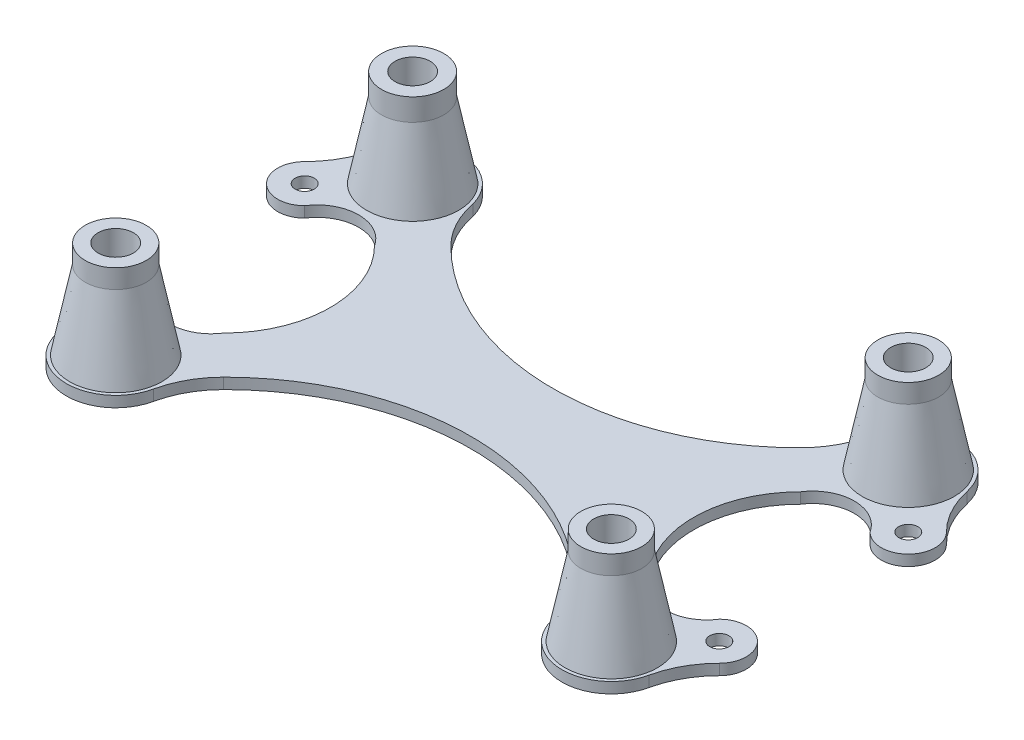
from build123d import *

# Parameters (mm, degrees)
BOSS_EXTRUDE1_DEPTH   = 2.54
SKETCH1_4_R           = 7.325
SKETCH1_4_R_2         = 4.15
SKETCH1_4_R_3         = 7.175
BOSS_EXTRUDE2_DEPTH   = 25.4
F_8_CLEARANCE_HOLE2_D = 4.4958
LPATTERN1_COUNT       = 2
LPATTERN1_PITCH       = 116.586
LPATTERN1_COUNT_DIR2  = 2
LPATTERN1_PITCH_DIR2  = 69.85


with BuildPart() as part:
    # Sketch1 → Boss-Extrude1 (new body)
    with BuildSketch(Plane(origin=(0, 0, 0), x_dir=(1, 0, 0), z_dir=(0, 1, 0))):
        with BuildLine():
            ThreePointArc((8.209871939, -17.190128061), (15.555896424, -34.925), (8.209871939, -52.659871939))
            ThreePointArc((8.209871939, -52.659871939), (0, -57.15), (-8.209871939, -52.659871939))
            ThreePointArc((-8.209871939, -52.659871939), (-17.190128061, -52.659871939), (-17.190128061, -61.640128061))
            ThreePointArc((-17.190128061, -61.640128061), (-13.499098781, -66.567297756), (-11.341832503, -72.333310292))
            ThreePointArc((-11.341832503, -72.333310292), (0, -81.460512242), (11.341832503, -72.333310292))
            ThreePointArc((11.341832503, -72.333310292), (13.499098781, -66.567297756), (17.190128061, -61.640128061))
            ThreePointArc((17.190128061, -61.640128061), (58.293, -44.614761051), (99.395871939, -61.640128061))
            ThreePointArc((99.395871939, -61.640128061), (103.086901219, -66.567297756), (105.244167497, -72.333310292))
            ThreePointArc((105.244167497, -72.333310292), (116.586, -81.460512242), (127.927832503, -72.333310292))
            ThreePointArc((127.927832503, -72.333310292), (130.085098781, -66.567297756), (133.776128061, -61.640128061))
            ThreePointArc((133.776128061, -61.640128061), (133.776128061, -52.659871939), (124.795871939, -52.659871939))
            ThreePointArc((124.795871939, -52.659871939), (116.586, -57.15), (108.376128061, -52.659871939))
            ThreePointArc((108.376128061, -52.659871939), (101.030103576, -34.925), (108.376128061, -17.190128061))
            ThreePointArc((108.376128061, -17.190128061), (116.586, -12.7), (124.795871939, -17.190128061))
            ThreePointArc((124.795871939, -17.190128061), (133.776128061, -17.190128061), (133.776128061, -8.209871939))
            ThreePointArc((133.776128061, -8.209871939), (130.085098781, -3.282702244), (127.927832503, 2.483310292))
            ThreePointArc((127.927832503, 2.483310292), (116.825136798, 11.608049281), (105.356064016, 2.948310079))
            ThreePointArc((105.356064016, 2.948310079), (103.204339104, -3.073259016), (99.395871939, -8.209871939))
            ThreePointArc((99.395871939, -8.209871939), (58.293, -25.235238949), (17.190128061, -8.209871939))
            ThreePointArc((17.190128061, -8.209871939), (13.381660896, -3.073259016), (11.229935984, 2.948310079))
            ThreePointArc((11.229935984, 2.948310079), (-0.239136798, 11.608049281), (-11.341832503, 2.483310292))
            ThreePointArc((-11.341832503, 2.483310292), (-13.499098781, -3.282702244), (-17.190128061, -8.209871939))
            ThreePointArc((-17.190128061, -8.209871939), (-17.190128061, -17.190128061), (-8.209871939, -17.190128061))
            ThreePointArc((-8.209871939, -17.190128061), (0, -12.7), (8.209871939, -17.190128061))
        make_face()
    extrude(amount=BOSS_EXTRUDE1_DEPTH)

    # Sketch1<4> → Boss-Extrude2 (add)
    # profile 1 of 4: a face of its own
    with BuildSketch(Plane(origin=(0, 0, 0), x_dir=(1, 0, 0), z_dir=(0, 1, 0))):
        Circle(SKETCH1_4_R)
        Circle(SKETCH1_4_R_2, mode=Mode.SUBTRACT)
    # profile 2 of 4: a face of its own
    with BuildSketch(Plane(origin=(0, 0, 0), x_dir=(1, 0, 0), z_dir=(0, 1, 0))):
        with Locations((116.586, 0)):
            Circle(SKETCH1_4_R_3)
        with Locations((116.586, 0)):
            Circle(SKETCH1_4_R_2, mode=Mode.SUBTRACT)
    # profile 3 of 4: a face of its own
    with BuildSketch(Plane(origin=(0, 0, 0), x_dir=(1, 0, 0), z_dir=(0, 1, 0))):
        with Locations((0, -69.85)):
            Circle(SKETCH1_4_R_3)
        with Locations((0, -69.85)):
            Circle(SKETCH1_4_R_2, mode=Mode.SUBTRACT)
    # profile 4 of 4: a face of its own
    with BuildSketch(Plane(origin=(0, 0, 0), x_dir=(1, 0, 0), z_dir=(0, 1, 0))):
        with Locations((116.586, -69.85)):
            Circle(SKETCH1_4_R_3)
        with Locations((116.586, -69.85)):
            Circle(SKETCH1_4_R_2, mode=Mode.SUBTRACT)
    extrude(amount=BOSS_EXTRUDE2_DEPTH)

    # #8 Clearance Hole2 (through all)
    with Locations(Plane(origin=(0, 2.54, 0), x_dir=(1, 0, 0), z_dir=(0, 1, 0))):
        with Locations((129.286, -12.7), (129.286, -57.15), (-12.7, -57.15), (-12.7, -12.7)):
            Hole(F_8_CLEARANCE_HOLE2_D / 2)

    # Sketch8 → Revolve1 (revolve)
    with BuildSketch(Plane(origin=(0, 0, 0), x_dir=(0, 0, -1), z_dir=(1, 0, 0))):
        Polygon((10.856911267, 2.54), (7.046911267, 21.59), (7.046911267, 2.54), align=None)
    revolve1 = revolve(axis=Axis((0, 0, 0), (0, 1, 0)))

    # LPattern1: Revolve1 2 × 2
    with Locations(*[(i * LPATTERN1_PITCH, 0, j * LPATTERN1_PITCH_DIR2) for i in range(LPATTERN1_COUNT) for j in range(LPATTERN1_COUNT_DIR2) if (i, j) != (0, 0)]):
        add(revolve1)


solid = part.part
